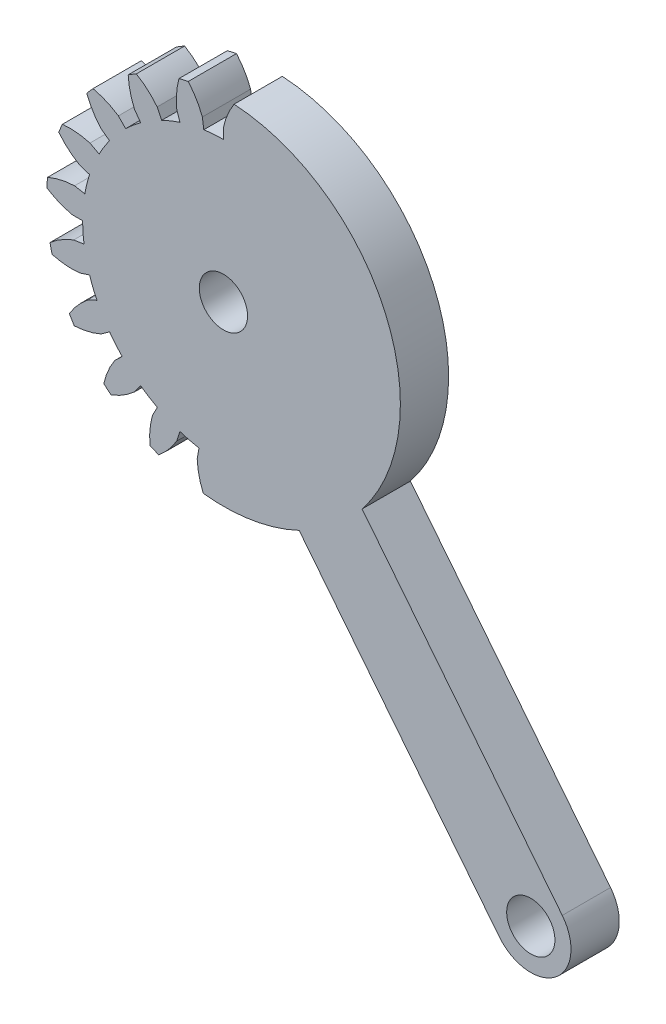
from build123d import *

# Parameters (mm, degrees)
EXTRUSION_DENTS_DEPTH        = 3
R_P_TITION_CIRCULAIRE2_COUNT = 20
ESQUISSE1_R                  = 8.75
EXTRUSION_DISQUE_DEPTH       = 3
BOSS_EXTRU_1_DEPTH           = 3
ESQUISSE6_R                  = 1.5
BOSS_EXTRU_2_DEPTH           = 3
ESQUISSE3_R                  = 1.5
ENL_V_MAT_EXTRU_1_DEPTH      = 35.358346143


with BuildPart() as part:
    # Esquisse2 → Extrusion dents (new body)
    with BuildSketch(Plane.XY):
        with BuildLine():
            Line((0, 9.396926208), (0, 8.75))
            ThreePointArc((0, 8.75), (0.761630034, 8.716789529), (1.517478561, 8.617410215))
            Line((1.517478561, 8.617410215), (1.629672464, 9.254533474))
            ThreePointArc((1.629672464, 9.254533474), (1.517874028, 10.109272502), (1.250299377, 10.928712251))
            ThreePointArc((1.250299377, 10.928712251), (0.956235935, 10.958358127), (0.661482168, 10.980092957))
            ThreePointArc((0.661482168, 10.980092957), (0.25763458, 10.219055101), (0, 9.396926208))
        make_face()
    extrude(amount=EXTRUSION_DENTS_DEPTH)


with BuildPart() as r_p_tition_circulaire2_1:
    # Répétition circulaire2: pattern copy
    add(part.part.rotate(Axis((0, 0, 0), (0, 0, 1)), 1 * 360 / R_P_TITION_CIRCULAIRE2_COUNT))


with BuildPart() as r_p_tition_circulaire2_2:
    # Répétition circulaire2: pattern copy
    add(part.part.rotate(Axis((0, 0, 0), (0, 0, 1)), 2 * 360 / R_P_TITION_CIRCULAIRE2_COUNT))


with BuildPart() as r_p_tition_circulaire2_3:
    # Répétition circulaire2: pattern copy
    add(part.part.rotate(Axis((0, 0, 0), (0, 0, 1)), 3 * 360 / R_P_TITION_CIRCULAIRE2_COUNT))


with BuildPart() as r_p_tition_circulaire2_4:
    # Répétition circulaire2: pattern copy
    add(part.part.rotate(Axis((0, 0, 0), (0, 0, 1)), 4 * 360 / R_P_TITION_CIRCULAIRE2_COUNT))


with BuildPart() as r_p_tition_circulaire2_5:
    # Répétition circulaire2: pattern copy
    add(part.part.rotate(Axis((0, 0, 0), (0, 0, 1)), 5 * 360 / R_P_TITION_CIRCULAIRE2_COUNT))


with BuildPart() as r_p_tition_circulaire2_6:
    # Répétition circulaire2: pattern copy
    add(part.part.rotate(Axis((0, 0, 0), (0, 0, 1)), 6 * 360 / R_P_TITION_CIRCULAIRE2_COUNT))


with BuildPart() as r_p_tition_circulaire2_7:
    # Répétition circulaire2: pattern copy
    add(part.part.rotate(Axis((0, 0, 0), (0, 0, 1)), 7 * 360 / R_P_TITION_CIRCULAIRE2_COUNT))


with BuildPart() as r_p_tition_circulaire2_8:
    # Répétition circulaire2: pattern copy
    add(part.part.rotate(Axis((0, 0, 0), (0, 0, 1)), 8 * 360 / R_P_TITION_CIRCULAIRE2_COUNT))


with BuildPart() as r_p_tition_circulaire2_9:
    # Répétition circulaire2: pattern copy
    add(part.part.rotate(Axis((0, 0, 0), (0, 0, 1)), 9 * 360 / R_P_TITION_CIRCULAIRE2_COUNT))


with BuildPart() as r_p_tition_circulaire2_10:
    # Répétition circulaire2: pattern copy
    add(part.part.rotate(Axis((0, 0, 0), (0, 0, 1)), 10 * 360 / R_P_TITION_CIRCULAIRE2_COUNT))


with BuildPart() as r_p_tition_circulaire2_11:
    # Répétition circulaire2: pattern copy
    add(part.part.rotate(Axis((0, 0, 0), (0, 0, 1)), 11 * 360 / R_P_TITION_CIRCULAIRE2_COUNT))


with BuildPart() as r_p_tition_circulaire2_12:
    # Répétition circulaire2: pattern copy
    add(part.part.rotate(Axis((0, 0, 0), (0, 0, 1)), 12 * 360 / R_P_TITION_CIRCULAIRE2_COUNT))


with BuildPart() as r_p_tition_circulaire2_13:
    # Répétition circulaire2: pattern copy
    add(part.part.rotate(Axis((0, 0, 0), (0, 0, 1)), 13 * 360 / R_P_TITION_CIRCULAIRE2_COUNT))


with BuildPart() as r_p_tition_circulaire2_14:
    # Répétition circulaire2: pattern copy
    add(part.part.rotate(Axis((0, 0, 0), (0, 0, 1)), 14 * 360 / R_P_TITION_CIRCULAIRE2_COUNT))


with BuildPart() as r_p_tition_circulaire2_15:
    # Répétition circulaire2: pattern copy
    add(part.part.rotate(Axis((0, 0, 0), (0, 0, 1)), 15 * 360 / R_P_TITION_CIRCULAIRE2_COUNT))


with BuildPart() as r_p_tition_circulaire2_16:
    # Répétition circulaire2: pattern copy
    add(part.part.rotate(Axis((0, 0, 0), (0, 0, 1)), 16 * 360 / R_P_TITION_CIRCULAIRE2_COUNT))


with BuildPart() as r_p_tition_circulaire2_17:
    # Répétition circulaire2: pattern copy
    add(part.part.rotate(Axis((0, 0, 0), (0, 0, 1)), 17 * 360 / R_P_TITION_CIRCULAIRE2_COUNT))


with BuildPart() as r_p_tition_circulaire2_18:
    # Répétition circulaire2: pattern copy
    add(part.part.rotate(Axis((0, 0, 0), (0, 0, 1)), 18 * 360 / R_P_TITION_CIRCULAIRE2_COUNT))


with BuildPart() as r_p_tition_circulaire2_19:
    # Répétition circulaire2: pattern copy
    add(part.part.rotate(Axis((0, 0, 0), (0, 0, 1)), 19 * 360 / R_P_TITION_CIRCULAIRE2_COUNT))


with BuildPart() as part_1:
    add(part.part)

    add(r_p_tition_circulaire2_1.part)  # Extrusion disque merges Répétition circulaire2_1

    add(r_p_tition_circulaire2_2.part)  # Extrusion disque merges Répétition circulaire2_2

    add(r_p_tition_circulaire2_3.part)  # Extrusion disque merges Répétition circulaire2_3

    add(r_p_tition_circulaire2_4.part)  # Extrusion disque merges Répétition circulaire2_4

    add(r_p_tition_circulaire2_5.part)  # Extrusion disque merges Répétition circulaire2_5

    add(r_p_tition_circulaire2_6.part)  # Extrusion disque merges Répétition circulaire2_6

    add(r_p_tition_circulaire2_7.part)  # Extrusion disque merges Répétition circulaire2_7

    add(r_p_tition_circulaire2_8.part)  # Extrusion disque merges Répétition circulaire2_8

    add(r_p_tition_circulaire2_9.part)  # Extrusion disque merges Répétition circulaire2_9

    add(r_p_tition_circulaire2_10.part)  # Extrusion disque merges Répétition circulaire2_10

    add(r_p_tition_circulaire2_11.part)  # Extrusion disque merges Répétition circulaire2_11

    add(r_p_tition_circulaire2_12.part)  # Extrusion disque merges Répétition circulaire2_12

    add(r_p_tition_circulaire2_13.part)  # Extrusion disque merges Répétition circulaire2_13

    add(r_p_tition_circulaire2_14.part)  # Extrusion disque merges Répétition circulaire2_14

    add(r_p_tition_circulaire2_15.part)  # Extrusion disque merges Répétition circulaire2_15

    add(r_p_tition_circulaire2_16.part)  # Extrusion disque merges Répétition circulaire2_16

    add(r_p_tition_circulaire2_17.part)  # Extrusion disque merges Répétition circulaire2_17

    add(r_p_tition_circulaire2_18.part)  # Extrusion disque merges Répétition circulaire2_18

    add(r_p_tition_circulaire2_19.part)  # Extrusion disque merges Répétition circulaire2_19
    # Esquisse1 → Extrusion disque (add)
    with BuildSketch(Plane.XY):
        Circle(ESQUISSE1_R)
    extrude(amount=EXTRUSION_DISQUE_DEPTH)

    # Esquisse5 → Boss.-Extru.1 (add)
    with BuildSketch(Plane(origin=(0, 0, 0), x_dir=(-1, 0, 0), z_dir=(0, 0, -1))):
        with BuildLine():
            Line((-0.957126431, 10.958280385), (0.957449481, -10.958252164))
            ThreePointArc((0.957449481, -10.958252164), (-10.958266276, -0.957287956), (-0.957126431, 10.958280385))
        make_face()
    extrude(amount=-BOSS_EXTRU_1_DEPTH)

    # Esquisse6 → Boss.-Extru.2 (add)
    with BuildSketch(Plane(origin=(0, 0, 0), x_dir=(-1, 0, 0), z_dir=(0, 0, -1))):
        with BuildLine():
            Line((-8.621821658, -6.83111933), (-21.064860521, -22.489049712))
            ThreePointArc((-21.064860521, -22.489049712), (-20.662999081, -26.001670868), (-17.150377925, -25.599809428))
            Line((-17.150377925, -25.599809428), (-4.707339063, -9.941879045))
            ThreePointArc((-4.707339063, -9.941879045), (-6.843671374, -8.61186171), (-8.621821658, -6.83111933))
        make_face()
        with Locations((-19.107619223, -24.04442957)):
            Circle(ESQUISSE6_R, mode=Mode.SUBTRACT)
    extrude(amount=-BOSS_EXTRU_2_DEPTH)

    # Esquisse3 → Enlèv. mat.-Extru.1 (cut, through all)
    with BuildSketch(Plane.XY.offset(3)):
        Circle(ESQUISSE3_R)
    extrude(amount=-ENL_V_MAT_EXTRU_1_DEPTH, mode=Mode.SUBTRACT)


solid = part_1.part
